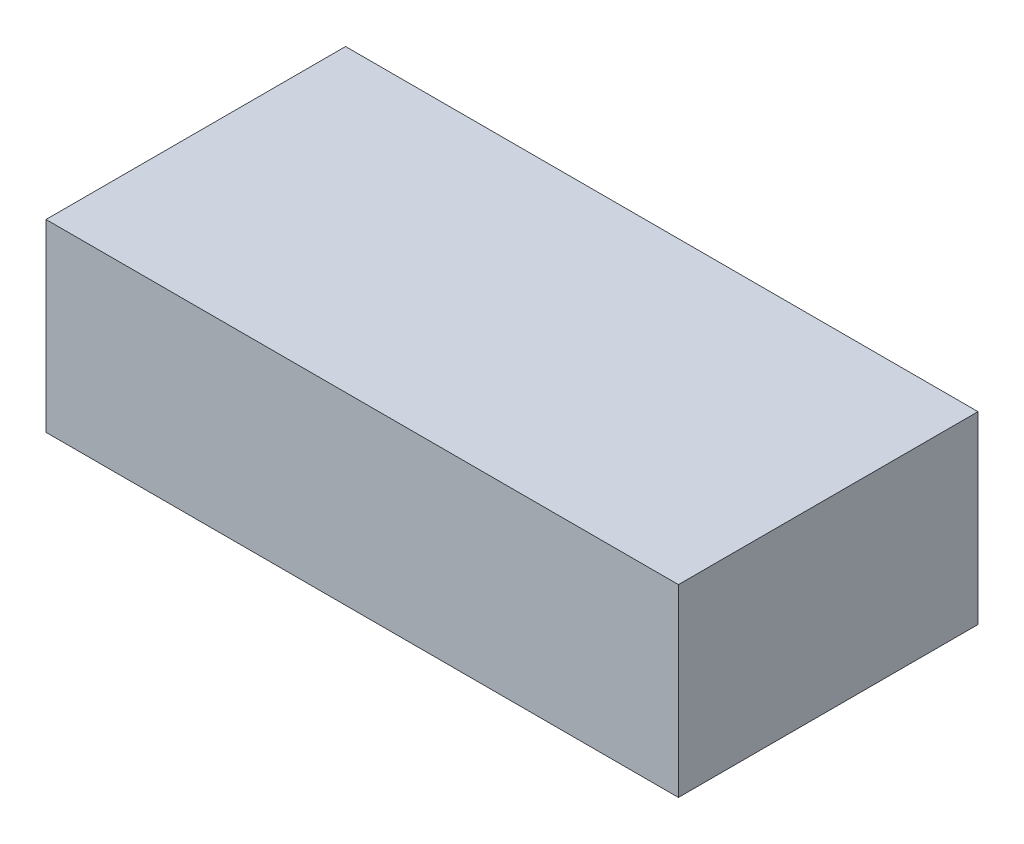
from build123d import *

# Parameters (mm, degrees)
SKETCH1_W           = 113.20034544
SKETCH1_H           = 53.621216261
BOSS_EXTRUDE1_DEPTH = 33


with BuildPart() as part:
    # Sketch1 → Boss-Extrude1 (new body)
    with BuildSketch(Plane(origin=(0, 0, 0), x_dir=(1, 0, 0), z_dir=(0, 1, 0))):
        with Locations((4.015115227, -2.460877074)):
            Rectangle(SKETCH1_W, SKETCH1_H)
    extrude(amount=BOSS_EXTRUDE1_DEPTH)


solid = part.part
